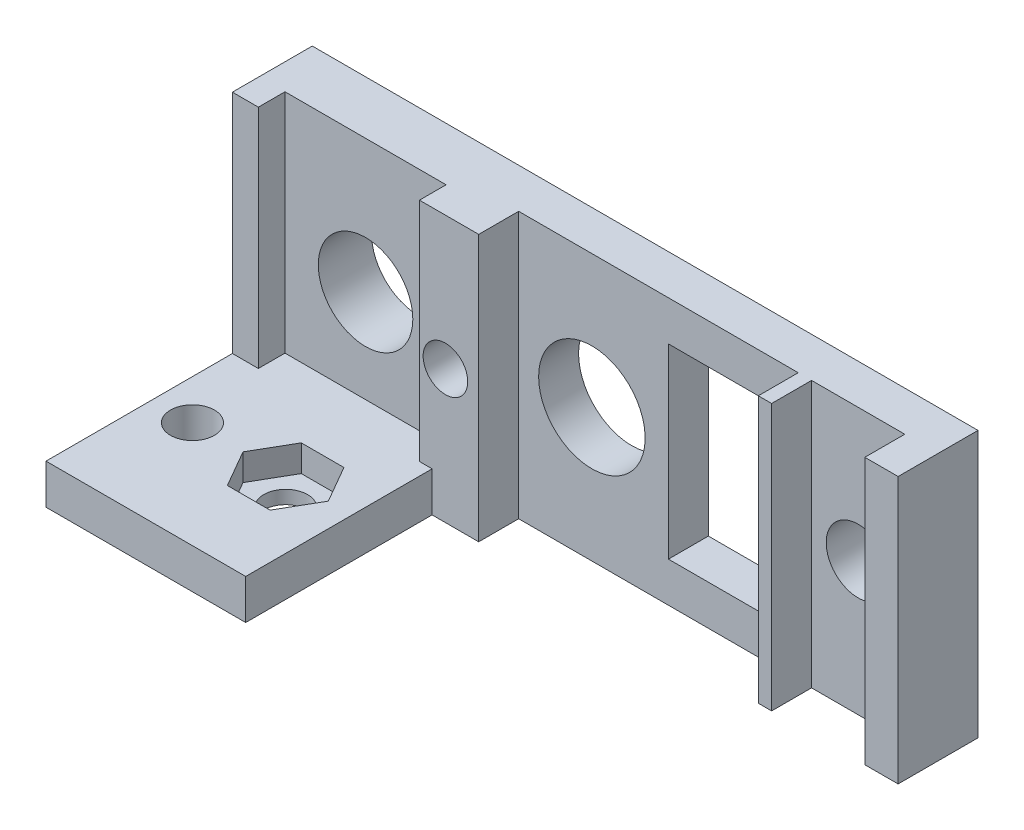
from build123d import *

# Parameters (mm, degrees)
SKETCH1_W           = 50
SKETCH1_H           = 20
SKETCH1_R           = 3.55
SKETCH1_R_2         = 1.675
SKETCH1_R_3         = 4
SKETCH1_R_4         = 2.4
SKETCH1_W_2         = 8.5
SKETCH1_H_2         = 14
BOSS_EXTRUDE1_DEPTH = 6
SKETCH3_W           = 11
SKETCH3_H           = 20
CUT_EXTRUDE2_DEPTH  = 3
SKETCH4_W           = 12.1
SKETCH4_H           = 20
CUT_EXTRUDE4_DEPTH  = 2
BOSS_EXTRUDE3_START = -3
SKETCH6_W           = 15
SKETCH6_H           = 20
BOSS_EXTRUDE3_DEPTH = 3
SKETCH7_R           = 1.65
CUT_EXTRUDE5_DEPTH  = 3
CUT_EXTRUDE6_DEPTH  = 2
SKETCH10_W          = 7
SKETCH10_H          = 20
SKETCH10_W_2        = 10
CUT_EXTRUDE7_DEPTH  = 3


with BuildPart() as part:
    # Sketch1 → Boss-Extrude1 (new body)
    with BuildSketch(Plane.XY):
        Rectangle(SKETCH1_W, SKETCH1_H)
        with Locations((-17, 0)):
            Circle(SKETCH1_R, mode=Mode.SUBTRACT)
        with Locations((-9, 0)):
            Circle(SKETCH1_R_2, mode=Mode.SUBTRACT)
        with Locations((-1, 0)):
            Circle(SKETCH1_R_3, mode=Mode.SUBTRACT)
        with Locations((19, 0)):
            Circle(SKETCH1_R_4, mode=Mode.SUBTRACT)
        with Locations((9, 0)):
            Rectangle(SKETCH1_W_2, SKETCH1_H_2, mode=Mode.SUBTRACT)
    extrude(amount=BOSS_EXTRUDE1_DEPTH)

    # Sketch3 → Cut-Extrude2 (cut)
    with BuildSketch(Plane.XY.offset(6)):
        with Locations((9, 0)):
            Rectangle(SKETCH3_W, SKETCH3_H)
    extrude(amount=-CUT_EXTRUDE2_DEPTH, mode=Mode.SUBTRACT)

    # Sketch4 → Cut-Extrude4 (cut)
    with BuildSketch(Plane.XY.offset(6)):
        with Locations((-17, 0)):
            Rectangle(SKETCH4_W, SKETCH4_H)
    extrude(amount=-CUT_EXTRUDE4_DEPTH, mode=Mode.SUBTRACT)

    # Sketch6 → Boss-Extrude3 (add)
    with BuildSketch(Plane.XZ.offset(10).offset(BOSS_EXTRUDE3_START)):
        with Locations((-17.5, 10)):
            Rectangle(SKETCH6_W, SKETCH6_H)
    extrude(amount=BOSS_EXTRUDE3_DEPTH)

    # Sketch7 → Cut-Extrude5 (cut)
    with BuildSketch(Plane(origin=(0, -7, 0), x_dir=(1, 0, 0), z_dir=(0, 1, 0))):
        with Locations(Location((-22, -12, 0), (0, 0, 180))):
            Circle(SKETCH7_R)
        with Locations(Location((-15, -12, 0), (0, 0, 180))):
            Circle(SKETCH7_R)
    extrude(amount=-CUT_EXTRUDE5_DEPTH, mode=Mode.SUBTRACT)

    # Sketch8 → Cut-Extrude6 (cut)
    with BuildSketch(Plane(origin=(0, -7, 0), x_dir=(1, 0, 0), z_dir=(0, 1, 0))):
        Polygon((-13.397853003, -9.225), (-16.602146997, -9.225), (-18.204293994, -12), (-16.602146997, -14.775), (-13.397853003, -14.775), (-11.795706006, -12), align=None)
    extrude(amount=-CUT_EXTRUDE6_DEPTH, mode=Mode.SUBTRACT)

    # Sketch10 → Cut-Extrude7 (cut)
    with BuildSketch(Plane.XY.offset(6)):
        with Locations((19, 0)):
            Rectangle(SKETCH10_W, SKETCH10_H)
        with Locations((-1.5, 0)):
            Rectangle(SKETCH10_W_2, SKETCH10_H)
    extrude(amount=-CUT_EXTRUDE7_DEPTH, mode=Mode.SUBTRACT)


solid = part.part
